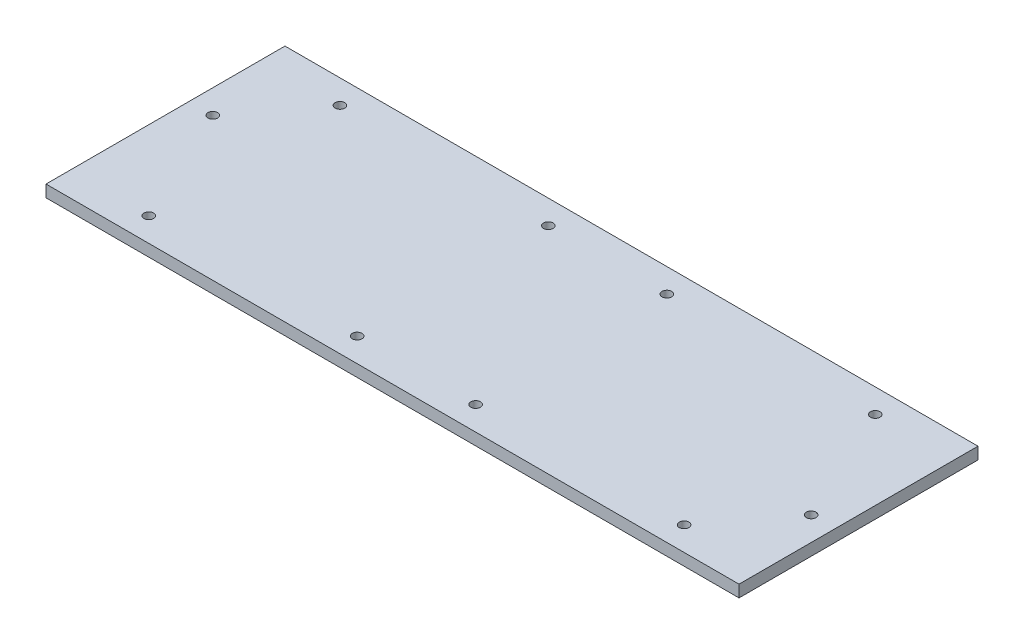
from build123d import *

# Parameters (mm, degrees)
SKETCH1_W           = 368.3
SKETCH1_H           = 127
SKETCH1_R           = 2.5527
BOSS_EXTRUDE1_DEPTH = 6.35


with BuildPart() as part:
    # Sketch1 → Boss-Extrude1 (new body)
    with BuildSketch(Plane(origin=(0, 0, 0), x_dir=(1, 0, 0), z_dir=(0, 1, 0))):
        with Locations((184.15, 63.5)):
            Rectangle(SKETCH1_W, SKETCH1_H)
        with Locations(Location((326.39, 12.7, 0), (0, 0, 270))):
            Circle(SKETCH1_R, mode=Mode.SUBTRACT)
        with Locations(Location((41.91, 12.7, 0), (0, 0, 270))):
            Circle(SKETCH1_R, mode=Mode.SUBTRACT)
        with Locations(Location((41.91, 114.3, 0), (0, 0, 270))):
            Circle(SKETCH1_R, mode=Mode.SUBTRACT)
        with Locations(Location((326.39, 114.3, 0), (0, 0, 270))):
            Circle(SKETCH1_R, mode=Mode.SUBTRACT)
        with Locations(Location((215.646, 12.7, 0), (0, 0, 270))):
            Circle(SKETCH1_R, mode=Mode.SUBTRACT)
        with Locations(Location((152.654, 12.7, 0), (0, 0, 270))):
            Circle(SKETCH1_R, mode=Mode.SUBTRACT)
        with Locations(Location((215.646, 114.3, 0), (0, 0, 270))):
            Circle(SKETCH1_R, mode=Mode.SUBTRACT)
        with Locations(Location((152.654, 114.3, 0), (0, 0, 270))):
            Circle(SKETCH1_R, mode=Mode.SUBTRACT)
        with Locations(Location((12.7, 75.946, 0), (0, 0, 270))):
            Circle(SKETCH1_R, mode=Mode.SUBTRACT)
        with Locations(Location((355.6, 51.054, 0), (0, 0, 270))):
            Circle(SKETCH1_R, mode=Mode.SUBTRACT)
    extrude(amount=BOSS_EXTRUDE1_DEPTH)


solid = part.part
